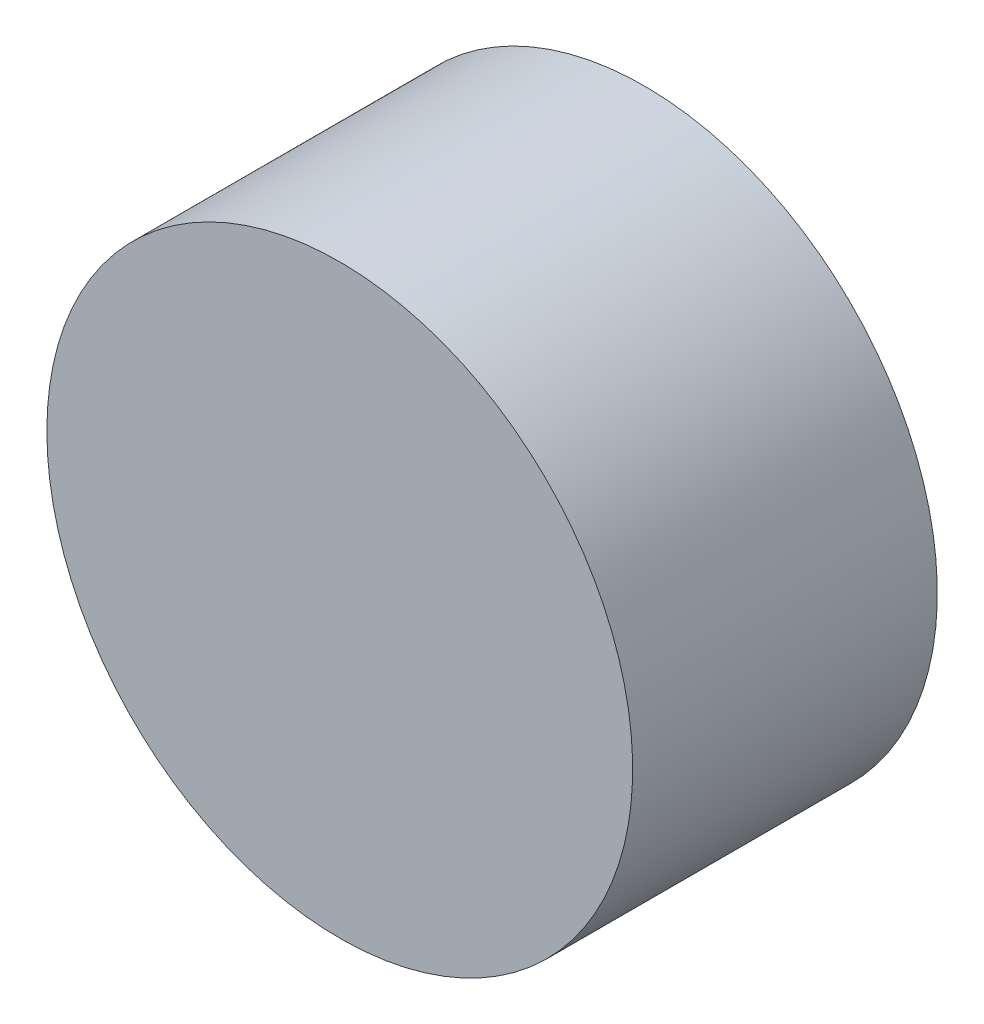
from build123d import *

# Parameters (mm, degrees)
SZKIC1_R                    = 12.5
DODANIE_WYCI_GNI_CIE2_DEPTH = 13
SZKIC2_R                    = 3.175
WYTNIJ_WYCI_GNI_CIE1_DEPTH  = 12


with BuildPart() as part:
    # Szkic1 → Dodanie-wyciągnięcie2 (new body)
    with BuildSketch(Plane.XY):
        with Locations(Location((0, 0, 0), (0, 0, 180))):
            Circle(SZKIC1_R)
    extrude(amount=DODANIE_WYCI_GNI_CIE2_DEPTH)

    # Szkic2 → Wytnij-wyciągnięcie1 (cut)
    with BuildSketch(Plane(origin=(0, 0, 0), x_dir=(-1, 0, 0), z_dir=(0, 0, -1))):
        Circle(SZKIC2_R)
    extrude(amount=-WYTNIJ_WYCI_GNI_CIE1_DEPTH, mode=Mode.SUBTRACT)


solid = part.part
